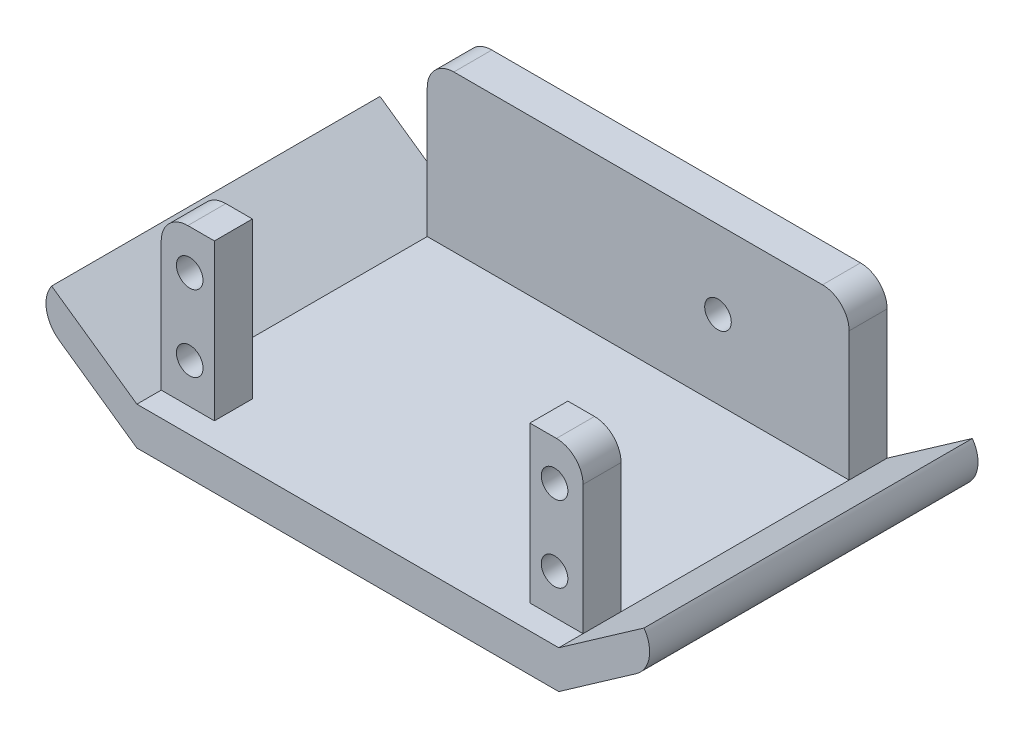
from build123d import *

# Parameters (mm, degrees)
SKETCH1_W           = 55.5
SKETCH1_H           = 43.2
BASE_DEPTH          = 5
SKETCH2_W           = 55.5
SKETCH2_H           = 25.5
WALL_DEPTH          = 5
SKETCH3_W           = 7
SKETCH3_H           = 20.5
MOUNTINGTABS_DEPTH  = 5
LIPS_REACH          = 76.811
SKETCH5_R           = 1.75
MOUNTINGHOLES_DEPTH = 5
FILLETS_R           = 3.5
SKETCH6_R           = 1.75
THROUGHHOLE_DEPTH   = 5


with BuildPart() as part:
    # Sketch1 → base (new body)
    with BuildSketch(Plane(origin=(0, 0, 0), x_dir=(1, 0, 0), z_dir=(0, 1, 0))):
        with Locations((27.75, 21.6)):
            Rectangle(SKETCH1_W, SKETCH1_H)
    extrude(amount=BASE_DEPTH)

    # Sketch2 → wall (add)
    with BuildSketch(Plane(origin=(0, 0, -43.2), x_dir=(-1, 0, 0), z_dir=(0, 0, -1))):
        with Locations((-27.75, 12.75)):
            Rectangle(SKETCH2_W, SKETCH2_H)
    extrude(amount=-WALL_DEPTH)

    # Sketch3 → mountingTabs (add)
    with BuildSketch(Plane.XY.offset(-8.2)):
        with Locations((3.5, 15.25)):
            Rectangle(SKETCH3_W, SKETCH3_H)
        with Locations((52, 15.25)):
            Rectangle(SKETCH3_W, SKETCH3_H)
    extrude(amount=MOUNTINGTABS_DEPTH)

    # lips: up to this face of the body (flat: up to its plane)
    lips_end = Plane(part.part.faces().sort_by_distance((27.75, 12.75, -43.2))[0])
    # Sketch4 → lips (add, up to the picked face)
    with BuildSketch(Plane.XY, mode=Mode.PRIVATE) as lips_sk1:
        with BuildLine():
            Line((0, 0), (-10.208884478, 7.148337868))
            ThreePointArc((-10.208884478, 7.148337868), (-11.894564223, 9.792816133), (-11.218174515, 12.85505036))
            Line((-11.218174515, 12.85505036), (0, 5))
            Line((0, 5), (0, 0))
        make_face()
    lips_tool1 = split(extrude(lips_sk1.sketch, amount=-LIPS_REACH, mode=Mode.PRIVATE), bisect_by=lips_end, keep=Keep.BOTH, mode=Mode.PRIVATE)
    # Sketch4 → lips (add, up to the picked face)
    with BuildSketch(Plane.XY, mode=Mode.PRIVATE) as lips_sk2:
        with BuildLine():
            Line((55.5, 5), (66.718174515, 12.85505036))
            ThreePointArc((66.718174515, 12.85505036), (67.394564223, 9.792816133), (65.708884478, 7.148337868))
            Line((65.708884478, 7.148337868), (55.5, 0))
            Line((55.5, 0), (55.5, 5))
        make_face()
    lips_tool2 = split(extrude(lips_sk2.sketch, amount=-LIPS_REACH, mode=Mode.PRIVATE), bisect_by=lips_end, keep=Keep.BOTH, mode=Mode.PRIVATE)
    add(lips_tool1.solids().sort_by(Axis((-5.839287, 6.590277, 0), (0, 0, -1)))[0])
    add(lips_tool2.solids().sort_by(Axis((61.339287, 6.590277, 0), (0, 0, -1)))[0])

    # Sketch5 → mountingHoles (cut)
    with BuildSketch(Plane.XY.offset(-3.2)):
        with Locations((3.75, 20.25)):
            Circle(SKETCH5_R)
        with Locations(Location((3.75, 10.25, 0), (0, 0, 180))):
            Circle(SKETCH5_R)
        with Locations((51.75, 10.25)):
            Circle(SKETCH5_R)
        with Locations(Location((51.75, 20.25, 0), (0, 0, 180))):
            Circle(SKETCH5_R)
    extrude(amount=-MOUNTINGHOLES_DEPTH, mode=Mode.SUBTRACT)

    # fillets
    fillets_edges = [part.edges().sort_by_distance(p)[0] for p in [
        (0, 25.5, -40.7),
        (55.5, 25.5, -40.7),
        (0, 25.5, -5.7),
        (55.5, 25.5, -5.7),
    ]]
    fillet(fillets_edges, radius=FILLETS_R)

    # Sketch6 → throughHole (cut)
    with BuildSketch(Plane.XY.offset(-38.2)):
        with Locations((38.25, 15.25)):
            Circle(SKETCH6_R)
    extrude(amount=-THROUGHHOLE_DEPTH, mode=Mode.SUBTRACT)


solid = part.part
